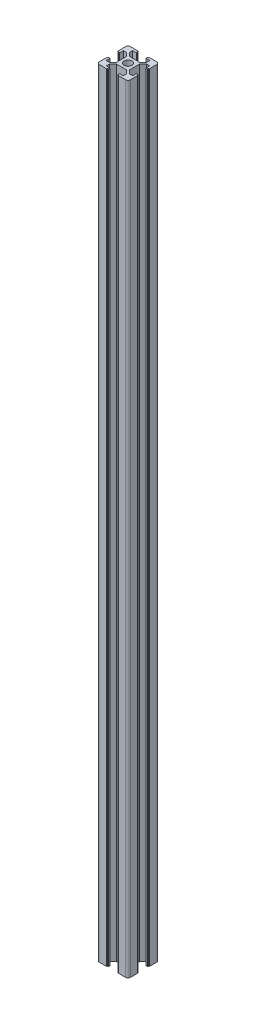
from build123d import *

# Parameters (mm, degrees)
BOSS_EXTRUDE1_DEPTH = 500
SKETCH3_R           = 2.5
CUT_EXTRUDE1_DEPTH  = 501.199960016
CIRPATTERN1_COUNT   = 4


with BuildPart() as part:
    # Sketch2 → Boss-Extrude1 (new body)
    with BuildSketch(Plane(origin=(0, 0, 0), x_dir=(1, 0, 0), z_dir=(0, 1, 0))):
        with BuildLine():
            Line((-10, -8.5), (-10, 8.5))
            ThreePointArc((-10, 8.5), (-9.560660172, 9.560660172), (-8.5, 10))
            Line((-8.5, 10), (8.5, 10))
            ThreePointArc((8.5, 10), (9.560660172, 9.560660172), (10, 8.5))
            Line((10, 8.5), (10, -8.5))
            ThreePointArc((10, -8.5), (9.560660172, -9.560660172), (8.5, -10))
            Line((8.5, -10), (-8.5, -10))
            ThreePointArc((-8.5, -10), (-9.560660172, -9.560660172), (-10, -8.5))
        make_face()
    extrude(amount=BOSS_EXTRUDE1_DEPTH)

    # Sketch3 → Cut-Extrude1 (cut, through all)
    with BuildSketch(Plane(origin=(0, 500, 0), x_dir=(1, 0, 0), z_dir=(0, 1, 0))):
        with BuildLine():
            Line((-6.348528137, -5.5), (-4.2, -3.351471863))
            Line((-4.2, -3.351471863), (-4.2, 3.351471863))
            Line((-4.2, 3.351471863), (-6.348528137, 5.5))
            Line((-6.348528137, 5.5), (-8.5, 5.5))
            Line((-8.5, 5.5), (-8.5, 3.1))
            Line((-8.5, 3.1), (-9.3, 3.1))
            ThreePointArc((-9.3, 3.1), (-9.441421356, 3.158578644), (-9.5, 3.3))
            Line((-9.5, 3.3), (-9.5, 3.6))
            Line((-9.5, 3.6), (-9.8, 3.6))
            ThreePointArc((-9.8, 3.6), (-9.941421356, 3.658578644), (-10, 3.8))
            Line((-10, 3.8), (-10, -3.8))
            ThreePointArc((-10, -3.8), (-9.941421356, -3.658578644), (-9.8, -3.6))
            Line((-9.8, -3.6), (-9.5, -3.6))
            Line((-9.5, -3.6), (-9.5, -3.3))
            ThreePointArc((-9.5, -3.3), (-9.441421356, -3.158578644), (-9.3, -3.1))
            Line((-9.3, -3.1), (-8.5, -3.1))
            Line((-8.5, -3.1), (-8.5, -5.5))
            Line((-8.5, -5.5), (-6.348528137, -5.5))
        make_face()
        Circle(SKETCH3_R)
    cut_extrude1 = extrude(amount=-CUT_EXTRUDE1_DEPTH, mode=Mode.SUBTRACT)

    # CirPattern1: Cut-Extrude1 ×4 about axis
    cirpattern1_axis = Axis((0, -20, 0), (0, 1, 0))
    for i in range(1, CIRPATTERN1_COUNT):
        add(cut_extrude1.rotate(cirpattern1_axis, i * 360 / CIRPATTERN1_COUNT), mode=Mode.SUBTRACT)


solid = part.part
